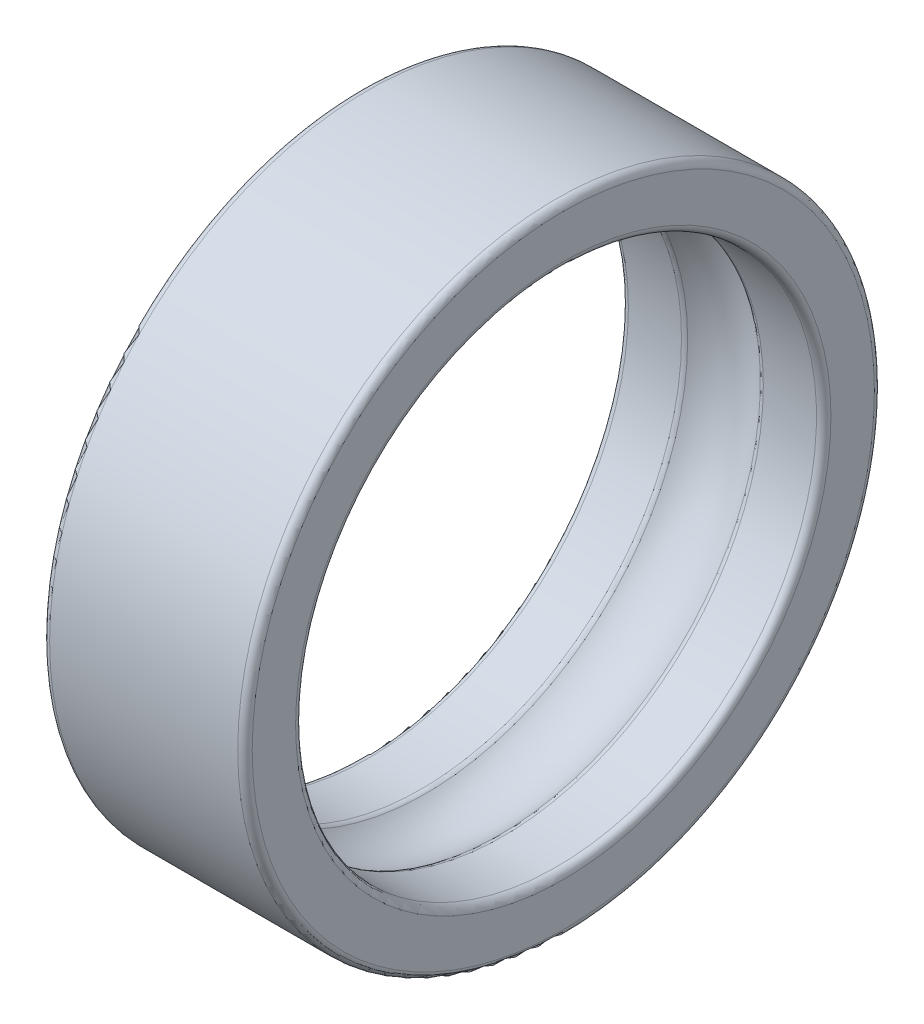
from build123d import *

# Parameters (mm, degrees)
CONG_1_R = 0.25


with BuildPart() as part:
    # Esquisse1 → Révolution1 (revolve)
    with BuildSketch(Plane.XY, mode=Mode.PRIVATE) as r_volution1_sk:
        with BuildLine():
            Line((1.322875656, 9), (3.5, 9))
            Line((3.5, 9), (3.5, 11))
            Line((3.5, 11), (-3.5, 11))
            Line((-3.5, 11), (-3.5, 9))
            Line((-3.5, 9), (-1.322875656, 9))
            ThreePointArc((-1.322875656, 9), (0, 9.5), (1.322875656, 9))
        make_face()
    revolve(r_volution1_sk.sketch.rotate(Axis((-31.667666126, 0, 0), (1, 0, 0)), 90), axis=Axis((-31.667666126, 0, 0), (1, 0, 0)))

    # Congé1
    cong_1_edges = [part.edges().sort_by_distance(p)[0] for p in [
        (1.322875656, 0, -9),
        (3.5, 0, -9),
        (3.5, 0, -11),
        (-3.5, 0, -11),
        (-3.5, 0, -9),
        (-1.322875656, 0, -9),
    ]]
    fillet(cong_1_edges, radius=CONG_1_R)


solid = part.part
